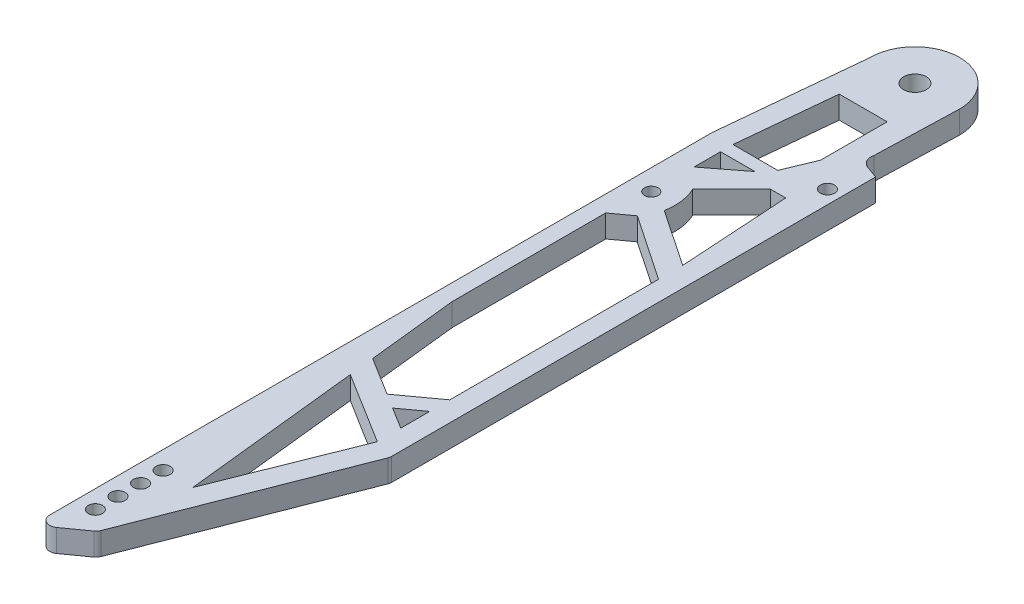
from build123d import *

# Parameters (mm, degrees)
SKETCH2_R           = 3.175
SKETCH2_R_2         = 2
SKETCH2_R_3         = 1.905
SKETCH2_R_4         = 1.999999991
BOSS_EXTRUDE1_DEPTH = 6.35
FILLET3_R           = 2.54
FILLET4_R           = 2.54
FILLET5_R           = 2.54


with BuildPart() as part:
    # Sketch2 → Boss-Extrude1 (new body)
    with BuildSketch(Plane(origin=(0, 0, 0), x_dir=(1, 0, 0), z_dir=(0, 1, 0))):
        with BuildLine():
            Line((13.846627418, -27.11715969), (17.295902343, -28.359470371))
            Line((17.295902343, -28.359470371), (17.295902343, -164.950770806))
            Line((17.295902343, -164.950770806), (-5.788689103, -224.106088723))
            Line((-5.788689103, -224.106088723), (-16.51, -231.775))
            Line((-16.51, -231.775), (-16.51, -118.11))
            Line((-16.51, -118.11), (-16.51, -40.527182032))
            Line((-16.51, -40.527182032), (-12.5603, 0))
            ThreePointArc((-12.5603, 0), (0, 12.5603), (12.5603, 0))
            Line((12.5603, 0), (11.834308479, -23.392641285))
            ThreePointArc((11.834308479, -23.392641285), (12.129138804, -25.639224299), (13.846627418, -27.11715969))
        make_face()
        with Locations(Location((0, 0, 0), (0, 0, 270))):
            Circle(SKETCH2_R, mode=Mode.SUBTRACT)
        with Locations(Location((-11.43, -219.075, 0), (0, 0, 270))):
            Circle(SKETCH2_R_2, mode=Mode.SUBTRACT)
        with Locations(Location((-11.43, -212.725, 0), (0, 0, 270))):
            Circle(SKETCH2_R_2, mode=Mode.SUBTRACT)
        with Locations(Location((-11.43, -206.375, 0), (0, 0, 270))):
            Circle(SKETCH2_R_2, mode=Mode.SUBTRACT)
        with Locations(Location((-11.43, -200.025, 0), (0, 0, 270))):
            Circle(SKETCH2_R_2, mode=Mode.SUBTRACT)
        with Locations(Location((-10.6553, -63.5, 0), (0, 0, 270))):
            Circle(SKETCH2_R_3, mode=Mode.SUBTRACT)
        with Locations(Location((13.485902343, -38.1, 0), (0, 0, 270))):
            Circle(SKETCH2_R_4, mode=Mode.SUBTRACT)
        Polygon((-3.088444979, -200.025), (-8.437091633, -150.367410486), (11.707902343, -162.914359455), align=None, mode=Mode.SUBTRACT)
        Polygon((5.669829362, -152.570430441), (11.707902343, -156.331136136), (11.707902343, -148.173239335), align=None, mode=Mode.SUBTRACT)
        Polygon((-9.197164207, -143.310789567), (1.48362655, -149.963128939), (11.707902343, -142.517360277), (11.707902343, -83.82613362), (-6.752611098, -71.345410911), (-11.894481361, -75.089947663), (-11.894481361, -118.268516882), align=None, mode=Mode.SUBTRACT)
        with BuildLine():
            Line((-5.45038708, -57.047318199), (5.477174601, -46.119756518))
            Line((5.477174601, -46.119756518), (9.770631453, -46.119756518))
            Line((9.770631453, -46.119756518), (11.707902343, -77.037423395))
            Line((11.707902343, -77.037423395), (-4.240626345, -66.254995008))
            ThreePointArc((-4.240626345, -66.254995008), (-4.111536449, -61.554723114), (-5.45038708, -57.047318199))
        make_face(mode=Mode.SUBTRACT)
        Polygon((-10.6553, -40.527182032), (-8.00152211, -13.297230483), (5.477174601, -13.297230483), (5.477174601, -31.974105906), (1.94113758, -40.527182032), align=None, mode=Mode.SUBTRACT)
        Polygon((-10.6553, -44.022777243), (-10.6553, -51.472145687), (-0.991335505, -44.022777243), align=None, mode=Mode.SUBTRACT)
    extrude(amount=BOSS_EXTRUDE1_DEPTH)

    # Fillet3
    fillet3_edges = [part.edges().sort_by_distance(p)[0] for p in [
        (-5.788689103, 3.175, 224.106088723),
    ]]
    fillet(fillet3_edges, radius=FILLET3_R)

    # Fillet4
    fillet4_edges = [part.edges().sort_by_distance(p)[0] for p in [
        (-16.51, 3.175, 231.775),
    ]]
    fillet(fillet4_edges, radius=FILLET4_R)

    # Fillet5
    fillet5_edges = [part.edges().sort_by_distance(p)[0] for p in [
        (17.295902343, 3.175, 164.950770806),
    ]]
    fillet(fillet5_edges, radius=FILLET5_R)


solid = part.part
